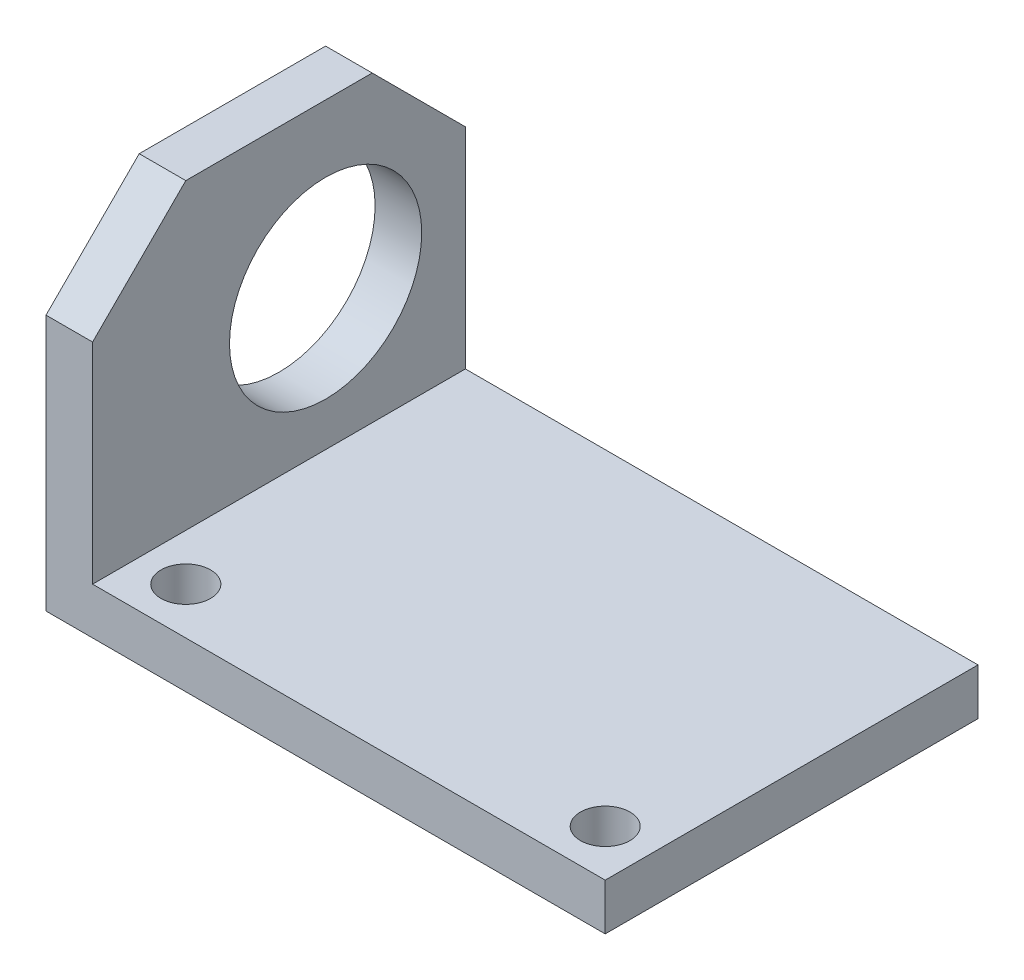
from build123d import *

# Parameters (mm, degrees)
BOSS_EXTRUDE1_DEPTH     = 25.4
F_1_4_CLEARANCE_HOLE1_D = 6.7564
F_1_CLEARANCE_HOLE1_D   = 26.19248
CHAMFER1_SIZE           = 12.7


with BuildPart() as part:
    # Sketch1 → Boss-Extrude1 (new, symmetric)
    with BuildSketch(Plane.XY):
        Polygon((0, 0), (76.2, 0), (76.2, 6.35), (6.35, 6.35), (6.35, 47.625), (0, 47.625), align=None)
    extrude(amount=BOSS_EXTRUDE1_DEPTH, both=True)

    # 1/4 Clearance Hole1 (through all)
    with Locations(Plane(origin=(0, 0, 0), x_dir=(-1, 0, 0), z_dir=(0, -1, 0))):
        with Locations((-12.7, -19.05), (-69.85, -19.05)):
            Hole(F_1_4_CLEARANCE_HOLE1_D / 2)

    # 1 Clearance Hole1 (through all)
    with Locations(Plane.ZY):
        with Locations((-6.35, 25.4)):
            Hole(F_1_CLEARANCE_HOLE1_D / 2)

    # Chamfer1
    chamfer1_edges = [part.edges().sort_by_distance(p)[0] for p in [
        (3.175, 47.625, 25.4),
        (3.175, 47.625, -25.4),
    ]]
    chamfer(chamfer1_edges, length=CHAMFER1_SIZE)


solid = part.part
